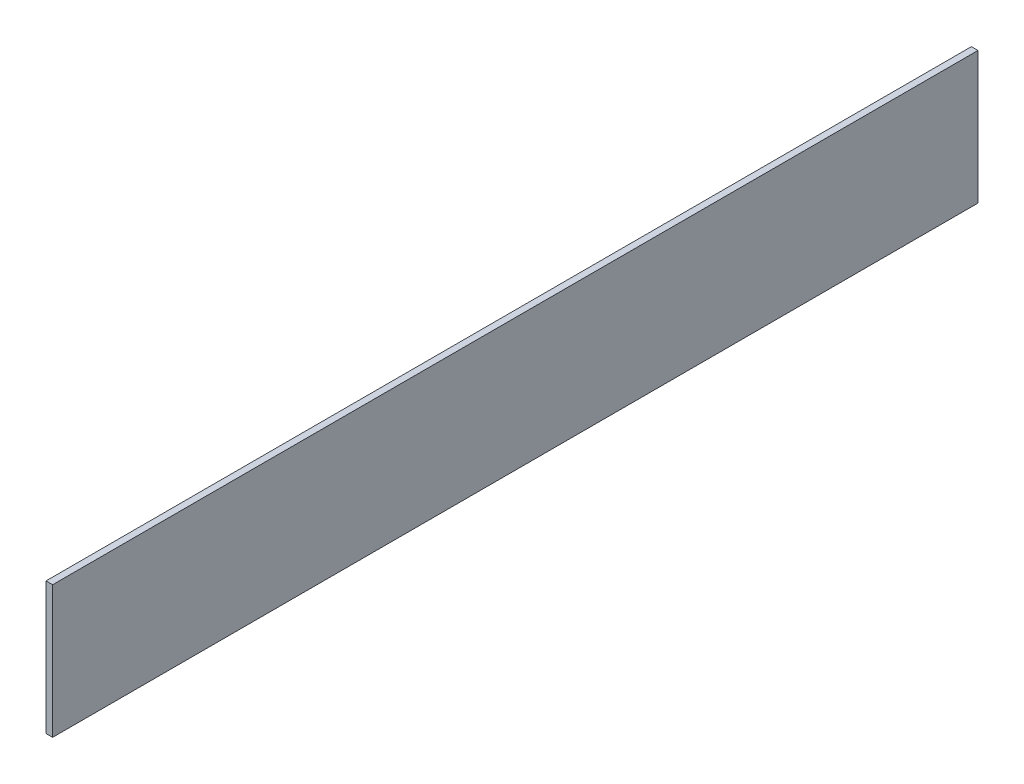
from build123d import *

# Parameters (mm, degrees)
OVEN_KESME_BICAK_2_2X28_T1_2_1_START = -160
SKETCH1_W                            = 2
SKETCH1_H                            = 40
OVEN_KESME_BICAK_2_2X28_T1_2_1_DEPTH = 280


with BuildPart() as part:
    # Sketch1 → OVEN_kesme_bicak_2_2x28_t1.2_1 (new body)
    with BuildSketch(Plane.XY.offset(OVEN_KESME_BICAK_2_2X28_T1_2_1_START)):
        with Locations((350, 380)):
            Rectangle(SKETCH1_W, SKETCH1_H)
    extrude(amount=-OVEN_KESME_BICAK_2_2X28_T1_2_1_DEPTH)


solid = part.part
